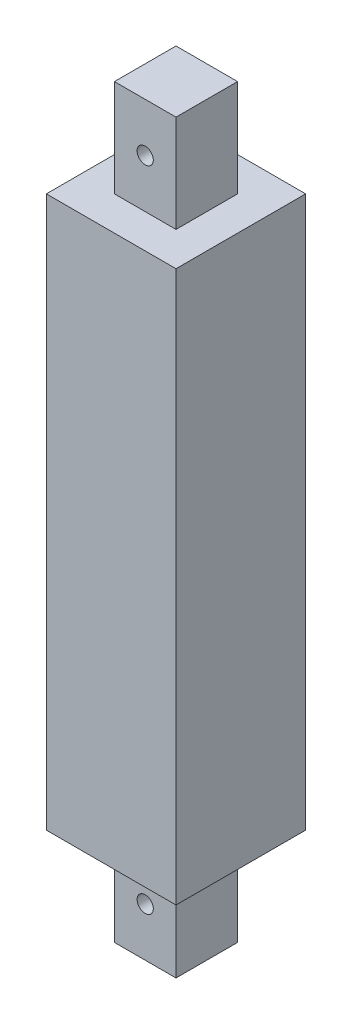
from build123d import *

# Parameters (mm, degrees)
SKETCH1_W           = 40
SKETCH1_H           = 40
BOSS_EXTRUDE1_DEPTH = 170
SKETCH2_W           = 19
SKETCH2_H           = 19
BOSS_EXTRUDE3_DEPTH = 30
SKETCH3_W           = 19
SKETCH3_H           = 19
BOSS_EXTRUDE4_DEPTH = 30
SKETCH4_R           = 2.5
CUT_EXTRUDE1_DEPTH  = 19


with BuildPart() as part:
    # Sketch1 → Boss-Extrude1 (new body)
    with BuildSketch(Plane(origin=(0, 0, 0), x_dir=(1, 0, 0), z_dir=(0, 1, 0))):
        Rectangle(SKETCH1_W, SKETCH1_H)
    extrude(amount=BOSS_EXTRUDE1_DEPTH)

    # Sketch2 → Boss-Extrude3 (add)
    with BuildSketch(Plane(origin=(0, 170, 0), x_dir=(1, 0, 0), z_dir=(0, 1, 0))):
        Rectangle(SKETCH2_W, SKETCH2_H)
    extrude(amount=BOSS_EXTRUDE3_DEPTH)

    # Sketch3 → Boss-Extrude4 (add)
    with BuildSketch(Plane.XZ):
        Rectangle(SKETCH3_W, SKETCH3_H)
    extrude(amount=BOSS_EXTRUDE4_DEPTH)

    # Sketch4 → Cut-Extrude1 (cut)
    with BuildSketch(Plane(origin=(0, 0, -9.5), x_dir=(-1, 0, 0), z_dir=(0, 0, -1))):
        with Locations((0, -15)):
            Circle(SKETCH4_R)
        with Locations((0, 185)):
            Circle(SKETCH4_R)
    extrude(amount=-CUT_EXTRUDE1_DEPTH, mode=Mode.SUBTRACT)


solid = part.part
